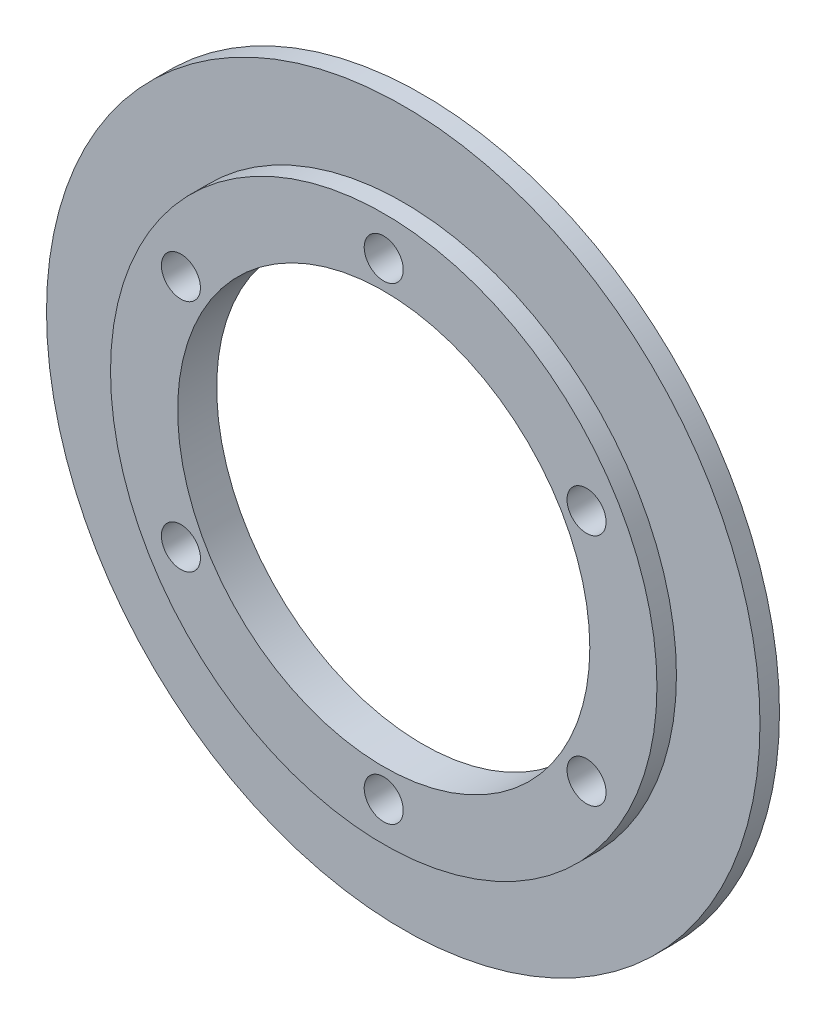
from build123d import *

# Parameters (mm, degrees)
SKETCH1_R               = 457
BOSS_EXTRUDE1_DEPTH     = 25
SKETCH2_R               = 350
BOSS_EXTRUDE2_DEPTH     = 25
CUT_EXTRUDE3_DEPTH      = 649.226812158
CUT_EXTRUDE3_DEPTH_BACK = 649.226812158
SKETCH3_R               = 25
SKETCH3_R_2             = 264


with BuildPart() as part:
    # Sketch1 → Boss-Extrude1 (new body)
    with BuildSketch(Plane.XY):
        Circle(SKETCH1_R)
    extrude(amount=BOSS_EXTRUDE1_DEPTH)

    # Sketch2 → Boss-Extrude2 (add)
    with BuildSketch(Plane.XY.offset(25)):
        Circle(SKETCH2_R)
    extrude(amount=BOSS_EXTRUDE2_DEPTH)

    # Sketch3 → Cut-Extrude3 (cut, two sides: drawn at the far end of the back side and taken through both)
    with BuildSketch(Plane.XY.offset(50).offset(-CUT_EXTRUDE3_DEPTH_BACK)):
        with Locations((0, 300)):
            Circle(SKETCH3_R)
        with Locations((259.807621135, 150)):
            Circle(SKETCH3_R)
        with Locations((259.807621135, -150)):
            Circle(SKETCH3_R)
        with Locations((0, -300)):
            Circle(SKETCH3_R)
        with Locations((-259.807621135, -150)):
            Circle(SKETCH3_R)
        with Locations((-259.807621135, 150)):
            Circle(SKETCH3_R)
        Circle(SKETCH3_R_2)
    extrude(amount=CUT_EXTRUDE3_DEPTH + CUT_EXTRUDE3_DEPTH_BACK, mode=Mode.SUBTRACT)


solid = part.part
